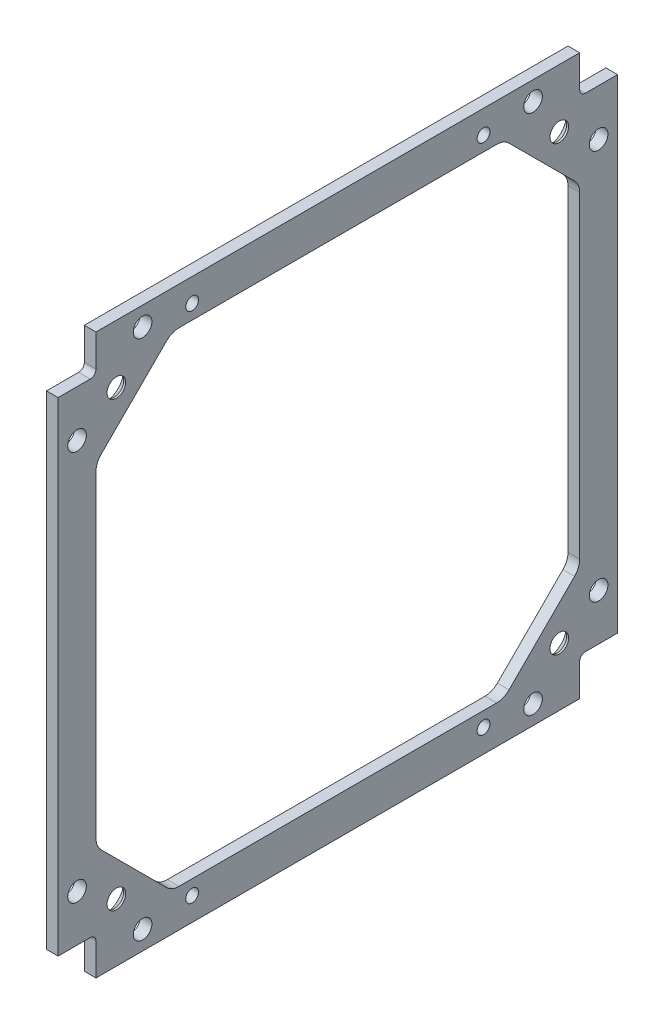
from build123d import *

# Parameters (mm, degrees)
BOSS_EXTRUDE2_DEPTH                          = 2
F_3_2_3_2_DIAMETER_HOLE3_D                   = 3.2
CSK_FOR_M3_FLAT_COUNTERSUNK_HEAD_SCR_2_COUNT = 2
CSK_FOR_M3_FLAT_COUNTERSUNK_HEAD_SCR_2_PITCH = 76
CSK_FOR_M3_FLAT_COUNTERSUNK_HEAD_SCR_3_COUNT = 2
CSK_FOR_M3_FLAT_COUNTERSUNK_HEAD_SCR_3_PITCH = 107.48023074
CSK_FOR_M3_FLAT_COUNTERSUNK_HEAD_SCR_4_COUNT = 2
CSK_FOR_M3_FLAT_COUNTERSUNK_HEAD_SCR_4_PITCH = 76
F_2_2_2_2_DIAMETER_HOLE1_D                   = 2.2
FILLET1_R                                    = 3
FILLET2_R                                    = 1


with BuildPart() as part:
    # Sketch2 → Boss-Extrude2 (new body)
    with BuildSketch(Plane.ZY.offset(51.493641502)):
        Polygon((0.93465612, 3.45185693), (7.43465612, 3.45185693), (7.43465612, 86.45185693), (0.93465612, 86.45185693), (0.93465612, 92.95185693), (-82.06534388, 92.95185693), (-82.06534388, 86.45185693), (-88.56534388, 86.45185693), (-88.56534388, 3.45185693), (-82.06534388, 3.45185693), (-82.06534388, -3.04814307), (0.93465612, -3.04814307), align=None)
        Polygon((-82.06534388, 73.45185693), (-82.06534388, 16.45185693), (-69.06534388, 3.45185693), (-12.06534388, 3.45185693), (0.93465612, 16.45185693), (0.93465612, 73.45185693), (-12.06534388, 86.45185693), (-69.06534388, 86.45185693), align=None, mode=Mode.SUBTRACT)
    extrude(amount=BOSS_EXTRUDE2_DEPTH)

    # Ø3.2 (3.2) Diameter Hole3 (through all)
    with Locations(Plane.ZY.offset(53.493641502)):
        with Locations((-74.06534388, 0.20185693), (-85.31534388, 11.45185693), (-85.31534388, 78.45185693), (-74.06534388, 89.70185693), (-7.06534388, 89.70185693), (4.18465612, 78.45185693), (4.18465612, 11.45185693), (-7.06534388, 0.20185693)):
            Hole(F_3_2_3_2_DIAMETER_HOLE3_D / 2)

    # Sketch24 → CSK for M3 Flat Countersunk Head Screw5 (revolve, cut)
    with BuildSketch(Plane(origin=(-53.493641502, 6.95185693, -78.56534388), x_dir=(0, 0, 1), z_dir=(0, 1, 0))):
        Polygon((0, 0), (0, 2), (1.6, 2), (1.6, 1.65), (3.25, 0), align=None)
    csk_for_m3_flat_countersunk_head_screw5 = revolve(axis=Axis((-59.843641502, 6.95185693, -78.56534388), (1, 0, 0)), mode=Mode.SUBTRACT)

    # CSK for M3 Flat Countersunk Head Scr 2: CSK for M3 Flat Countersunk Head Screw5 ×2
    with Locations(*[(0, i * CSK_FOR_M3_FLAT_COUNTERSUNK_HEAD_SCR_2_PITCH, 0) for i in range(1, CSK_FOR_M3_FLAT_COUNTERSUNK_HEAD_SCR_2_COUNT)]):
        add(csk_for_m3_flat_countersunk_head_screw5, mode=Mode.SUBTRACT)

    # CSK for M3 Flat Countersunk Head Scr 3: CSK for M3 Flat Countersunk Head Screw5 ×2
    with Locations(*[Vector(0, 0.7071067811865478, 0.7071067811865472) * (i * CSK_FOR_M3_FLAT_COUNTERSUNK_HEAD_SCR_3_PITCH) for i in range(1, CSK_FOR_M3_FLAT_COUNTERSUNK_HEAD_SCR_3_COUNT)]):
        add(csk_for_m3_flat_countersunk_head_screw5, mode=Mode.SUBTRACT)

    # CSK for M3 Flat Countersunk Head Scr 4: CSK for M3 Flat Countersunk Head Screw5 ×2
    with Locations(*[(0, 0, i * CSK_FOR_M3_FLAT_COUNTERSUNK_HEAD_SCR_4_PITCH) for i in range(1, CSK_FOR_M3_FLAT_COUNTERSUNK_HEAD_SCR_4_COUNT)]):
        add(csk_for_m3_flat_countersunk_head_screw5, mode=Mode.SUBTRACT)

    # Ø2.2 (2.2) Diameter Hole1 (through all)
    with Locations(Plane(origin=(-53.493641502, 88.95185693, -65.56534388), x_dir=(0, 0, -1), z_dir=(-1, 0, 0))):
        with Locations((0, 0), (-50, 0), (0, 88), (-50, 88)):
            Hole(F_2_2_2_2_DIAMETER_HOLE1_D / 2)

    # Fillet1
    fillet1_edges = [part.edges().sort_by_distance(p)[0] for p in [
        (-52.493641502, 86.45185693, -69.06534388),
        (-52.493641502, 73.45185693, -82.06534388),
        (-52.493641502, 16.45185693, -82.06534388),
        (-52.493641502, 3.45185693, -69.06534388),
        (-52.493641502, 3.45185693, -12.06534388),
        (-52.493641502, 16.45185693, 0.93465612),
        (-52.493641502, 73.45185693, 0.93465612),
        (-52.493641502, 86.45185693, -12.06534388),
    ]]
    fillet(fillet1_edges, radius=FILLET1_R)

    # Fillet2
    fillet2_edges = [part.edges().sort_by_distance(p)[0] for p in [
        (-52.493641502, 3.45185693, -82.06534388),
        (-52.493641502, 86.45185693, -82.06534388),
        (-52.493641502, 86.45185693, 0.93465612),
        (-52.493641502, 3.45185693, 0.93465612),
    ]]
    fillet(fillet2_edges, radius=FILLET2_R)


solid = part.part
